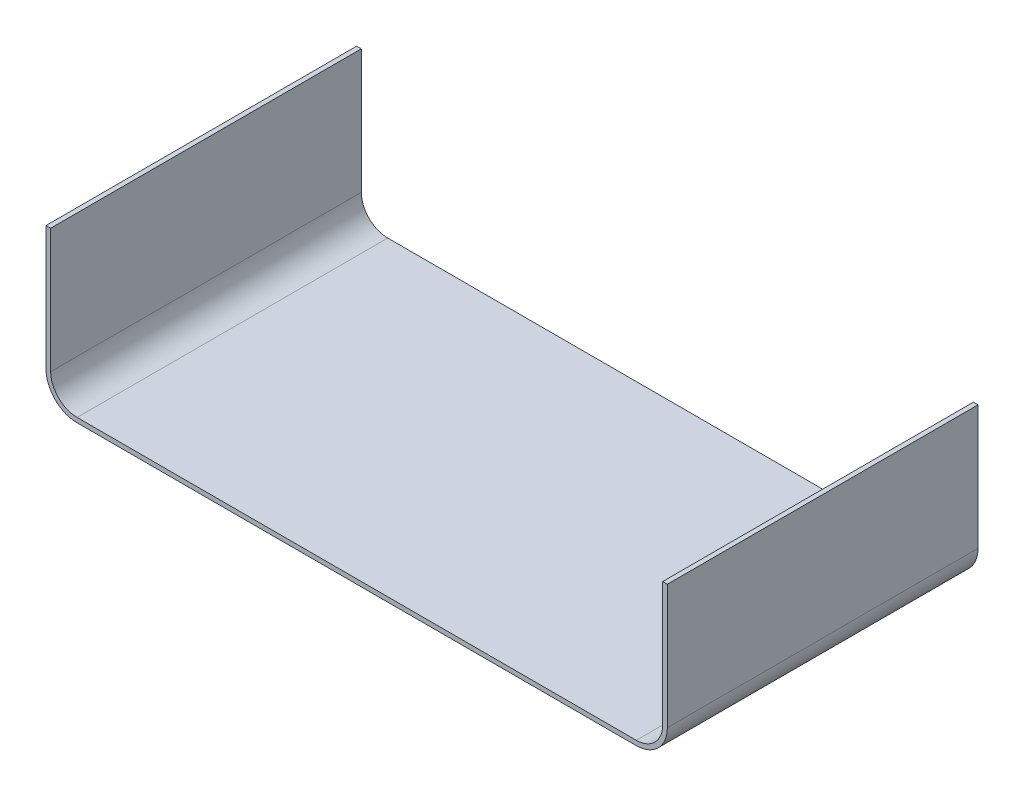
from build123d import *

# Parameters (mm, degrees)
SKETCH_1_W      = 400
SKETCH_1_H      = 100
EXTRUDE_1_DEPTH = 200
FILLET_1_R      = 20
SHELL_1_T       = -3


with BuildPart() as part:
    # 草圖1 → 伸長1 (new body)
    with BuildSketch(Plane.XY):
        with Locations((0, 50)):
            Rectangle(SKETCH_1_W, SKETCH_1_H)
    extrude(amount=EXTRUDE_1_DEPTH)

    # 圓角1
    fillet_1_edges = [part.edges().sort_by_distance(p)[0] for p in [
        (200, 0, 100),
        (-200, 0, 100),
    ]]
    fillet(fillet_1_edges, radius=FILLET_1_R)

    # 薄殼1
    shell_1_openings = [part.faces().sort_by_distance(p)[0] for p in [
        (0, 50.196270167, 200),
        (0, 50.196270167, 0),
        (0, 100, 100),
    ]]
    offset(amount=SHELL_1_T, openings=shell_1_openings, kind=Kind.INTERSECTION)


solid = part.part
